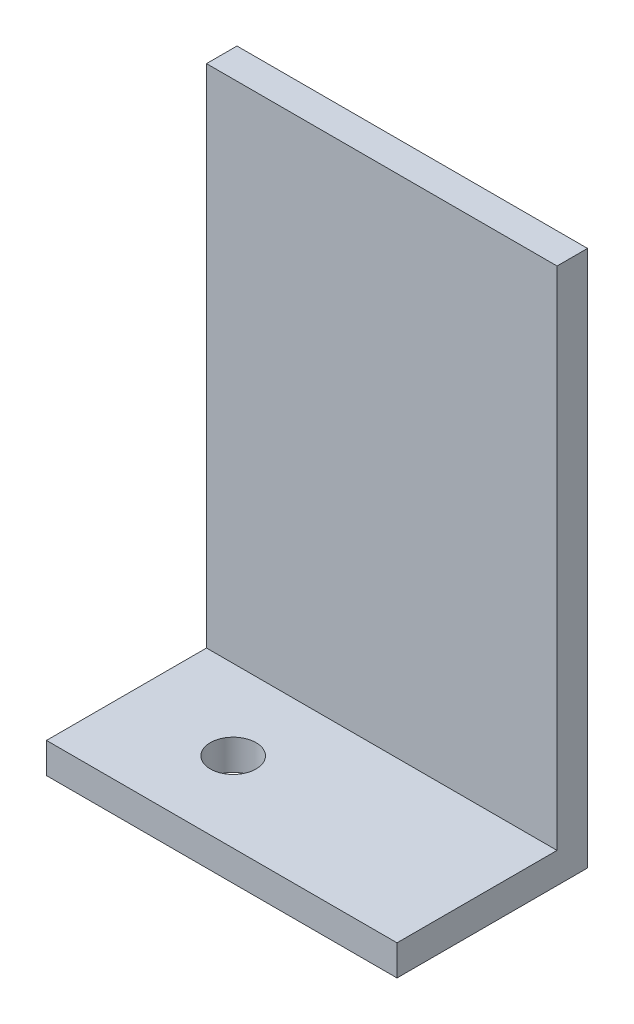
from build123d import *

# Parameters (mm, degrees)
SKETCH1_W           = 23
SKETCH1_H           = 12.5
BOSS_EXTRUDE1_DEPTH = 2
SKETCH2_W           = 23
SKETCH2_H           = 33.206230298
BOSS_EXTRUDE2_DEPTH = 2
SKETCH3_R           = 1.5
CUT_EXTRUDE1_DEPTH  = 2


with BuildPart() as part:
    # Sketch1 → Boss-Extrude1 (new body)
    with BuildSketch(Plane(origin=(0, 0, 0), x_dir=(1, 0, 0), z_dir=(0, 1, 0))):
        with Locations((11.5, 6.25)):
            Rectangle(SKETCH1_W, SKETCH1_H)
    extrude(amount=BOSS_EXTRUDE1_DEPTH)

    # Sketch2 → Boss-Extrude2 (add)
    with BuildSketch(Plane(origin=(0, 0, -12.5), x_dir=(-1, 0, 0), z_dir=(0, 0, -1))):
        with Locations((-11.5, 18.603115149)):
            Rectangle(SKETCH2_W, SKETCH2_H)
    extrude(amount=-BOSS_EXTRUDE2_DEPTH)

    # Sketch3 → Cut-Extrude1 (cut)
    with BuildSketch(Plane(origin=(0, 2, 0), x_dir=(1, 0, 0), z_dir=(0, 1, 0))):
        with Locations(Location((7, 5.25, 0), (0, 0, 270))):
            Circle(SKETCH3_R)
    extrude(amount=-CUT_EXTRUDE1_DEPTH, mode=Mode.SUBTRACT)


solid = part.part
